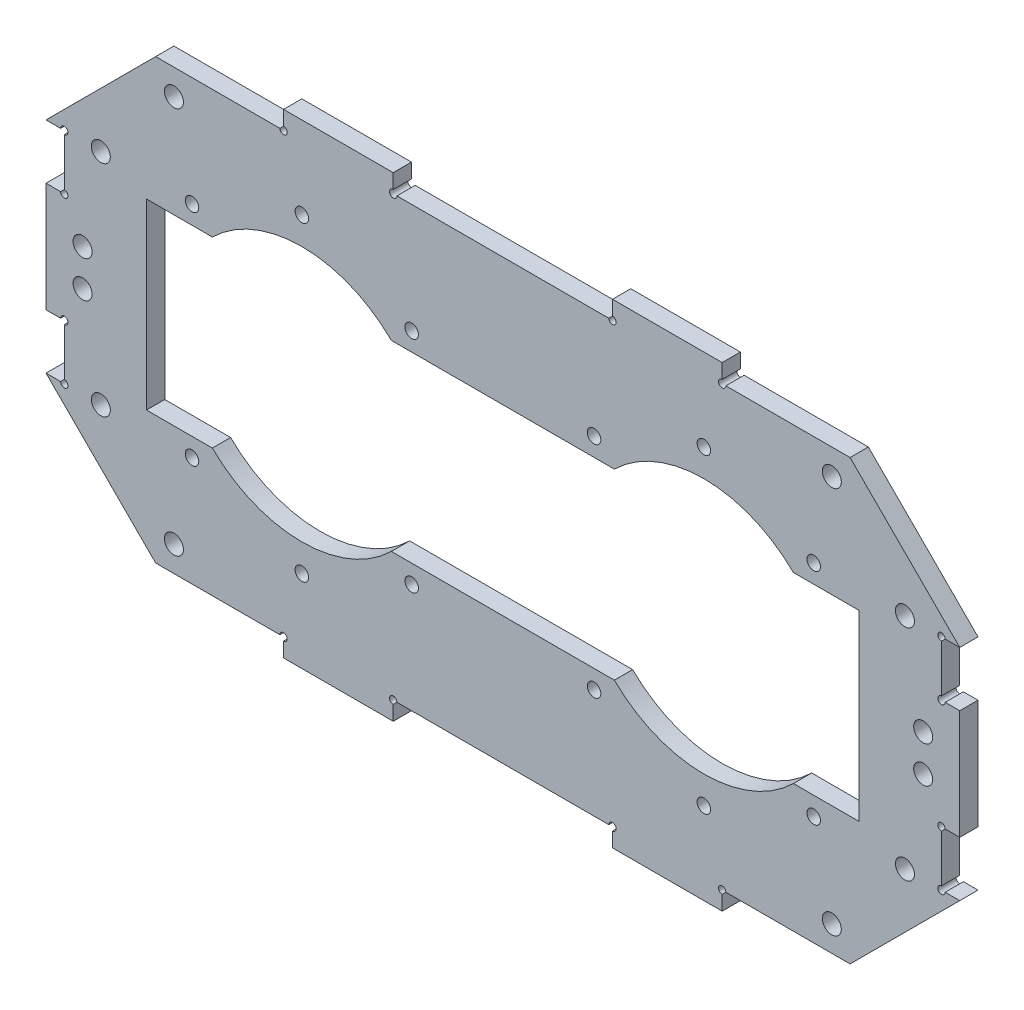
from build123d import *

# Parameters (mm, degrees)
EXTRUDE_1_DEPTH     = 5
SKETCH_2_W          = 5
SKETCH_2_H          = 15
CUT_EXTRUDE_1_DEPTH = 5
SKETCH_3_R          = 1.85
CUT_EXTRUDE_3_DEPTH = 5
CUT_EXTRUDE_4_DEPTH = 5
CUT_EXTRUDE_5_DEPTH = 5
SKETCH_6_W          = 5
SKETCH_6_H          = 50
EXTRUDE_2_DEPTH     = 15
SKETCH_7_W          = 5
SKETCH_7_H          = 50
EXTRUDE_3_DEPTH     = 15
SKETCH_8_W          = 30
SKETCH_8_H          = 5
EXTRUDE_4_DEPTH     = 5
SKETCH_9_R          = 1
CUT_EXTRUDE_6_DEPTH = 5
SKETCH_10_R         = 2.6
CUT_EXTRUDE_7_DEPTH = 142.471025812


with BuildPart() as part:
    # 草图1 → 凸台-拉伸1 (new body)
    with BuildSketch(Plane.XY):
        Polygon((95.399429803, 59.700427648), (125.399429803, 29.700427648), (125.399429803, -30.299572352), (95.399429803, -60.299572352), (-94.600570197, -60.299572352), (-124.600570197, -30.299572352), (-124.600570197, 29.700427648), (-94.600570197, 59.700427648), align=None)
    extrude(amount=EXTRUDE_1_DEPTH)

    # 草图2 → 切除-拉伸1 (cut)
    with BuildSketch(Plane.XY.offset(5)):
        with Locations((-122.100570197, 22.200427648)):
            Rectangle(SKETCH_2_W, SKETCH_2_H)
        with Locations((-122.100570197, -22.799572352)):
            Rectangle(SKETCH_2_W, SKETCH_2_H)
        with Locations((122.899429803, -22.799572352)):
            Rectangle(SKETCH_2_W, SKETCH_2_H)
        with Locations((122.899429803, 22.200427648)):
            Rectangle(SKETCH_2_W, SKETCH_2_H)
    extrude(amount=-CUT_EXTRUDE_1_DEPTH, mode=Mode.SUBTRACT)

    # 草图3 → 切除-拉伸3 (cut)
    # profile 1 of 16: a face of its own
    with BuildSketch(Plane.XY.offset(5)):
        Polygon((112.899429803, 24.700427648), (82.899429803, 24.700427648), (-112.100570197, 24.700427648), (-112.100570197, -25.299572352), (82.899429803, -25.299572352), (112.899429803, -25.299572352), align=None)
        with Locations((-97.100570197, -0.299572352)):
            Circle(SKETCH_3_R, mode=Mode.SUBTRACT)
        with Locations((-12.100570197, -0.299572352)):
            Circle(SKETCH_3_R, mode=Mode.SUBTRACT)
        with Locations((12.899429803, -0.299572352)):
            Circle(SKETCH_3_R, mode=Mode.SUBTRACT)
        with Locations((97.899429803, -0.299572352)):
            Circle(SKETCH_3_R, mode=Mode.SUBTRACT)
    # profile 2 of 16: a face of its own
    with BuildSketch(Plane.XY.offset(5)):
        with Locations((-84.652608397, -30.351610553)):
            Circle(SKETCH_3_R)
    # profile 3 of 16: a face of its own
    with BuildSketch(Plane.XY.offset(5)):
        with Locations((-54.600570197, -42.799572352)):
            Circle(SKETCH_3_R)
    # profile 4 of 16: a face of its own
    with BuildSketch(Plane.XY.offset(5)):
        with Locations((-24.548531996, -30.351610553)):
            Circle(SKETCH_3_R)
    # profile 5 of 16: a face of its own
    with BuildSketch(Plane.XY.offset(5)):
        with Locations((-12.100570197, -0.299572352)):
            Circle(SKETCH_3_R)
    # profile 6 of 16: a face of its own
    with BuildSketch(Plane.XY.offset(5)):
        with Locations((-24.548531996, 29.752465848)):
            Circle(SKETCH_3_R)
    # profile 7 of 16: a face of its own
    with BuildSketch(Plane.XY.offset(5)):
        with Locations((25.347391603, -30.351610553)):
            Circle(SKETCH_3_R)
    # profile 8 of 16: a face of its own
    with BuildSketch(Plane.XY.offset(5)):
        with Locations((55.399429803, -42.799572352)):
            Circle(SKETCH_3_R)
    # profile 9 of 16: a face of its own
    with BuildSketch(Plane.XY.offset(5)):
        with Locations((85.451468004, -30.351610553)):
            Circle(SKETCH_3_R)
    # profile 10 of 16: a face of its own
    with BuildSketch(Plane.XY.offset(5)):
        with Locations((85.451468004, 29.752465848)):
            Circle(SKETCH_3_R)
    # profile 11 of 16: a face of its own
    with BuildSketch(Plane.XY.offset(5)):
        with Locations((55.399429803, 42.200427648)):
            Circle(SKETCH_3_R)
    # profile 12 of 16: a face of its own
    with BuildSketch(Plane.XY.offset(5)):
        with Locations((25.347391603, 29.752465848)):
            Circle(SKETCH_3_R)
    # profile 13 of 16: a face of its own
    with BuildSketch(Plane.XY.offset(5)):
        with Locations((12.899429803, -0.299572352)):
            Circle(SKETCH_3_R)
    # profile 14 of 16: a face of its own
    with BuildSketch(Plane.XY.offset(5)):
        with Locations((97.899429803, -0.299572352)):
            Circle(SKETCH_3_R)
    # profile 15 of 16: a face of its own
    with BuildSketch(Plane.XY.offset(5)):
        with Locations((-54.600570197, 42.200427648)):
            Circle(SKETCH_3_R)
    # profile 16 of 16: a face of its own
    with BuildSketch(Plane.XY.offset(5)):
        with Locations((-84.652608397, 29.752465848)):
            Circle(SKETCH_3_R)
    extrude(amount=-CUT_EXTRUDE_3_DEPTH, mode=Mode.SUBTRACT)


with BuildPart() as cut_extrude_3_kept_piece:
    # of the separate pieces the step leaves, the one the design keeps (cut_extrude_3_pieces_kept)
    add(part.part.solids().sort_by_distance((95.399429803, 59.700427648, 0))[0])

    # 草图4 → 切除-拉伸4 (cut)
    with BuildSketch(Plane.XY.offset(5)):
        with BuildLine():
            Line((-79.095467625, 24.700427648), (-30.105672769, 24.700427648))
            ThreePointArc((-30.105672769, 24.700427648), (-54.600570197, 34.700427648), (-79.095467625, 24.700427648))
        make_face()
        with BuildLine():
            ThreePointArc((-79.095467625, -25.299572352), (-54.600570197, -35.299572352), (-30.105672769, -25.299572352))
            Line((-30.105672769, -25.299572352), (-79.095467625, -25.299572352))
        make_face()
        with BuildLine():
            ThreePointArc((30.904532375, -25.299572352), (55.399429803, -35.299572352), (79.894327231, -25.299572352))
            Line((79.894327231, -25.299572352), (30.904532375, -25.299572352))
        make_face()
        with BuildLine():
            ThreePointArc((79.894327231, 24.700427648), (55.399429803, 34.700427648), (30.904532375, 24.700427648))
            Line((30.904532375, 24.700427648), (79.894327231, 24.700427648))
        make_face()
    extrude(amount=-CUT_EXTRUDE_4_DEPTH, mode=Mode.SUBTRACT)

    # 草图5 → 切除-拉伸5 (cut)
    with BuildSketch(Plane.XY.offset(5)):
        with BuildLine():
            ThreePointArc((-118.600570197, 29.700427648), (-119.600570197, 30.700427648), (-120.600570197, 29.700427648))
            Line((-120.600570197, 29.700427648), (-119.600570197, 29.700427648))
            Line((-119.600570197, 29.700427648), (-119.600570197, 28.700427648))
            ThreePointArc((-119.600570197, 28.700427648), (-118.893463416, 28.993320866), (-118.600570197, 29.700427648))
        make_face()
        with BuildLine():
            Line((-119.600570197, 29.700427648), (-120.600570197, 29.700427648))
            ThreePointArc((-120.600570197, 29.700427648), (-120.307676978, 28.993320866), (-119.600570197, 28.700427648))
            Line((-119.600570197, 28.700427648), (-119.600570197, 29.700427648))
        make_face()
        with BuildLine():
            ThreePointArc((-118.600570197, 14.700427648), (-118.893463416, 15.407534429), (-119.600570197, 15.700427648))
            Line((-119.600570197, 15.700427648), (-119.600570197, 14.700427648))
            Line((-119.600570197, 14.700427648), (-120.600570197, 14.700427648))
            ThreePointArc((-120.600570197, 14.700427648), (-119.600570197, 13.700427648), (-118.600570197, 14.700427648))
        make_face()
        with BuildLine():
            Line((-119.600570197, 14.700427648), (-119.600570197, 15.700427648))
            ThreePointArc((-119.600570197, 15.700427648), (-120.307676978, 15.407534429), (-120.600570197, 14.700427648))
            Line((-120.600570197, 14.700427648), (-119.600570197, 14.700427648))
        make_face()
        with BuildLine():
            ThreePointArc((-120.600570197, -15.299572352), (-120.307676978, -16.006679134), (-119.600570197, -16.299572352))
            Line((-119.600570197, -16.299572352), (-119.600570197, -15.299572352))
            Line((-119.600570197, -15.299572352), (-120.600570197, -15.299572352))
        make_face()
        with BuildLine():
            Line((-119.600570197, -15.299572352), (-119.600570197, -16.299572352))
            ThreePointArc((-119.600570197, -16.299572352), (-118.893463416, -16.006679134), (-118.600570197, -15.299572352))
            ThreePointArc((-118.600570197, -15.299572352), (-119.600570197, -14.299572352), (-120.600570197, -15.299572352))
            Line((-120.600570197, -15.299572352), (-119.600570197, -15.299572352))
        make_face()
        with BuildLine():
            ThreePointArc((-119.600570197, -29.299572352), (-120.307676978, -29.592465571), (-120.600570197, -30.299572352))
            Line((-120.600570197, -30.299572352), (-119.600570197, -30.299572352))
            Line((-119.600570197, -30.299572352), (-119.600570197, -29.299572352))
        make_face()
        with BuildLine():
            Line((-119.600570197, -30.299572352), (-120.600570197, -30.299572352))
            ThreePointArc((-120.600570197, -30.299572352), (-119.600570197, -31.299572352), (-118.600570197, -30.299572352))
            ThreePointArc((-118.600570197, -30.299572352), (-118.893463416, -29.592465571), (-119.600570197, -29.299572352))
            Line((-119.600570197, -29.299572352), (-119.600570197, -30.299572352))
        make_face()
        with BuildLine():
            ThreePointArc((120.399429803, 28.700427648), (121.106536584, 28.993320866), (121.399429803, 29.700427648))
            Line((121.399429803, 29.700427648), (120.399429803, 29.700427648))
            Line((120.399429803, 29.700427648), (120.399429803, 28.700427648))
        make_face()
        with BuildLine():
            Line((120.399429803, 29.700427648), (121.399429803, 29.700427648))
            ThreePointArc((121.399429803, 29.700427648), (119.692323022, 30.407534429), (120.399429803, 28.700427648))
            Line((120.399429803, 28.700427648), (120.399429803, 29.700427648))
        make_face()
        with BuildLine():
            ThreePointArc((121.399429803, 14.700427648), (121.106536584, 15.407534429), (120.399429803, 15.700427648))
            Line((120.399429803, 15.700427648), (120.399429803, 14.700427648))
            Line((120.399429803, 14.700427648), (121.399429803, 14.700427648))
        make_face()
        with BuildLine():
            Line((120.399429803, 14.700427648), (120.399429803, 15.700427648))
            ThreePointArc((120.399429803, 15.700427648), (119.692323022, 13.993320866), (121.399429803, 14.700427648))
            Line((121.399429803, 14.700427648), (120.399429803, 14.700427648))
        make_face()
        with BuildLine():
            ThreePointArc((121.399429803, -15.299572352), (119.692323022, -14.592465571), (120.399429803, -16.299572352))
            Line((120.399429803, -16.299572352), (120.399429803, -15.299572352))
            Line((120.399429803, -15.299572352), (121.399429803, -15.299572352))
        make_face()
        with BuildLine():
            Line((120.399429803, -15.299572352), (120.399429803, -16.299572352))
            ThreePointArc((120.399429803, -16.299572352), (121.106536584, -16.006679134), (121.399429803, -15.299572352))
            Line((121.399429803, -15.299572352), (120.399429803, -15.299572352))
        make_face()
        with BuildLine():
            ThreePointArc((120.399429803, -29.299572352), (119.692323022, -31.006679134), (121.399429803, -30.299572352))
            Line((121.399429803, -30.299572352), (120.399429803, -30.299572352))
            Line((120.399429803, -30.299572352), (120.399429803, -29.299572352))
        make_face()
        with BuildLine():
            Line((120.399429803, -30.299572352), (121.399429803, -30.299572352))
            ThreePointArc((121.399429803, -30.299572352), (121.106536584, -29.592465571), (120.399429803, -29.299572352))
            Line((120.399429803, -29.299572352), (120.399429803, -30.299572352))
        make_face()
    extrude(amount=-CUT_EXTRUDE_5_DEPTH, mode=Mode.SUBTRACT)

    # 草图6 → 凸台-拉伸2 (add)
    with BuildSketch(Plane(origin=(-112.100570197, 0, 0), x_dir=(0, 0, -1), z_dir=(1, 0, 0))):
        with Locations((-2.5, -0.299572352)):
            Rectangle(SKETCH_6_W, SKETCH_6_H)
    extrude(amount=EXTRUDE_2_DEPTH)

    # 草图7 → 凸台-拉伸3 (add)
    with BuildSketch(Plane.ZY.offset(-112.899429803)):
        with Locations((2.5, -0.299572352)):
            Rectangle(SKETCH_7_W, SKETCH_7_H)
    extrude(amount=EXTRUDE_3_DEPTH)

    # 草图8 → 凸台-拉伸4 (add)
    with BuildSketch(Plane.XY.offset(5)):
        with BuildLine():
            ThreePointArc((-30.600570197, 59.700427648), (-30.307676978, 60.407534429), (-29.600570197, 60.700427648))
            Line((-29.600570197, 60.700427648), (-29.600570197, 64.700427648))
            Line((-29.600570197, 64.700427648), (-59.600570197, 64.700427648))
            Line((-59.600570197, 64.700427648), (-59.600570197, 60.700427648))
            ThreePointArc((-59.600570197, 60.700427648), (-58.893463416, 60.407534429), (-58.600570197, 59.700427648))
            Line((-58.600570197, 59.700427648), (-30.600570197, 59.700427648))
        make_face()
        with BuildLine():
            ThreePointArc((-29.600570197, -61.299572352), (-30.307676978, -61.006679134), (-30.600570197, -60.299572352))
            Line((-30.600570197, -60.299572352), (-58.600570197, -60.299572352))
            ThreePointArc((-58.600570197, -60.299572352), (-58.893463416, -61.006679134), (-59.600570197, -61.299572352))
            Line((-59.600570197, -61.299572352), (-59.600570197, -65.299572352))
            Line((-59.600570197, -65.299572352), (-29.600570197, -65.299572352))
            Line((-29.600570197, -65.299572352), (-29.600570197, -61.299572352))
        make_face()
        with Locations((45.399429803, -62.799572352)):
            Rectangle(SKETCH_8_W, SKETCH_8_H)
        with Locations((45.399429803, 62.200427648)):
            Rectangle(SKETCH_8_W, SKETCH_8_H)
    extrude(amount=-EXTRUDE_4_DEPTH)

    # 草图9 → 切除-拉伸6 (cut)
    with BuildSketch(Plane.XY.offset(5)):
        with Locations((30.399429803, 59.700427648)):
            Circle(SKETCH_9_R)
        with Locations((60.399429803, -60.299572352)):
            Circle(SKETCH_9_R)
        with Locations((30.399429803, -60.299572352)):
            Circle(SKETCH_9_R)
        with Locations((-59.600570197, -60.299572352)):
            Circle(SKETCH_9_R)
        with Locations((-29.600570197, -60.299572352)):
            Circle(SKETCH_9_R)
        with Locations((-29.600570197, 59.700427648)):
            Circle(SKETCH_9_R)
        with Locations((-59.600570197, 59.700427648)):
            Circle(SKETCH_9_R)
        with Locations((60.399429803, 59.700427648)):
            Circle(SKETCH_9_R)
    extrude(amount=-CUT_EXTRUDE_6_DEPTH, mode=Mode.SUBTRACT)

    # 草图10 → 切除-拉伸7 (cut, through all)
    with BuildSketch(Plane.XY.offset(5)):
        with Locations((-114.600570197, -5.299572352)):
            Circle(SKETCH_10_R)
        with Locations((-109.600570197, -30.299572352)):
            Circle(SKETCH_10_R)
        with Locations((-89.600570197, -53.299572352)):
            Circle(SKETCH_10_R)
        with Locations((115.399429803, -5.299572352)):
            Circle(SKETCH_10_R)
        with Locations((110.399429803, -30.299572352)):
            Circle(SKETCH_10_R)
        with Locations((90.399429803, -53.299572352)):
            Circle(SKETCH_10_R)
        with Locations(Location((-114.600570197, 4.700427648, 0), (0, 0, 180))):
            Circle(SKETCH_10_R)
        with Locations(Location((-109.600570197, 29.700427648, 0), (0, 0, 180))):
            Circle(SKETCH_10_R)
        with Locations(Location((-89.600570197, 52.700427648, 0), (0, 0, 180))):
            Circle(SKETCH_10_R)
        with Locations((90.399429803, 52.700427648)):
            Circle(SKETCH_10_R)
        with Locations((110.399429803, 29.700427648)):
            Circle(SKETCH_10_R)
        with Locations((115.399429803, 4.700427648)):
            Circle(SKETCH_10_R)
    extrude(amount=-CUT_EXTRUDE_7_DEPTH, mode=Mode.SUBTRACT)


solid = cut_extrude_3_kept_piece.part
